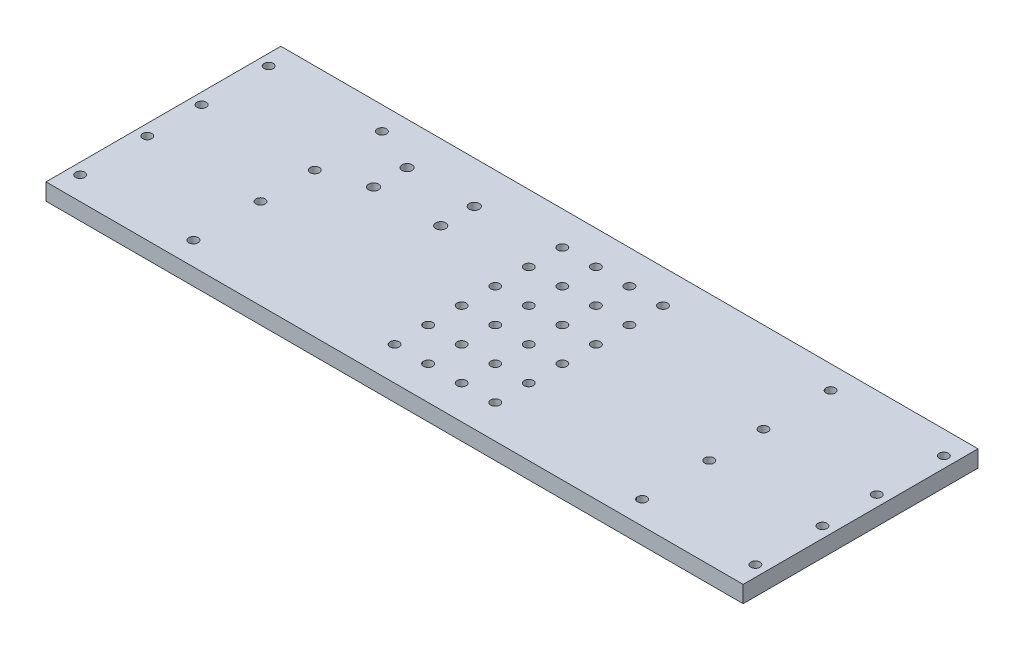
from build123d import *

# Parameters (mm, degrees)
SKETCH1_W              = 263.906
SKETCH1_H              = 88.9
BOSS_EXTRUDE1_DEPTH    = 6.35
F_8_32_TAPPED_HOLE2_D  = 3.4544
F_10_24_TAPPED_HOLE1_D = 3.7973
F_8_32_TAPPED_HOLE3_D  = 3.4544


with BuildPart() as part:
    # Sketch1 → Boss-Extrude1 (new body)
    with BuildSketch(Plane(origin=(0, 0, 0), x_dir=(1, 0, 0), z_dir=(0, 1, 0))):
        with Locations((51.789802803, -18.848747716)):
            Rectangle(SKETCH1_W, SKETCH1_H)
    extrude(amount=BOSS_EXTRUDE1_DEPTH)

    # #8-32 Tapped Hole2 (through all)
    with Locations(Plane(origin=(0, 6.35, 0), x_dir=(1, 0, 0), z_dir=(0, 1, 0))):
        with Locations((-76.003947197, 16.825552284), (-33.141447197, 16.825552284), (-33.141447197, -8.574447716), (-76.003947197, -8.574447716), (-76.003947197, -29.123047716), (-33.141447197, -29.123047716), (-33.141447197, -54.523047716), (-76.003947197, -54.523047716), (179.583552803, 16.825552284), (179.583552803, -8.574447716), (179.583552803, -29.123047716), (179.583552803, -54.523047716), (136.721052803, -54.523047716), (136.721052803, -29.123047716), (136.721052803, -8.574447716), (136.721052803, 16.825552284)):
            Hole(F_8_32_TAPPED_HOLE2_D / 2)

    # #10-24 Tapped Hole1 (through all)
    with Locations(Plane(origin=(0, 6.35, 0), x_dir=(1, 0, 0), z_dir=(0, 1, 0))):
        with Locations((-16.472697197, 9.726252284), (-16.472697197, -2.973747716), (8.927302803, -2.973747716), (8.927302803, 9.726252284)):
            Hole(F_10_24_TAPPED_HOLE1_D / 2)

    # #8-32 Tapped Hole3 (through all)
    with Locations(Plane(origin=(0, 6.35, 0), x_dir=(1, 0, 0), z_dir=(0, 1, 0))):
        with Locations((39.089802803, -50.598747716), (64.489802803, -50.598747716), (51.789802803, -50.598747716), (77.189802803, -50.598747716), (51.789802803, -37.898747716), (77.189802803, -37.898747716), (51.789802803, -25.198747716), (77.189802803, -25.198747716), (51.789802803, -12.498747716), (77.189802803, -12.498747716), (51.789802803, 0.201252284), (77.189802803, 0.201252284), (51.789802803, 12.901252284), (77.189802803, 12.901252284), (39.089802803, -37.898747716), (64.489802803, -37.898747716), (39.089802803, -25.198747716), (64.489802803, -25.198747716), (39.089802803, -12.498747716), (64.489802803, -12.498747716), (39.089802803, 0.201252284), (64.489802803, 0.201252284), (39.089802803, 12.901252284), (64.489802803, 12.901252284)):
            Hole(F_8_32_TAPPED_HOLE3_D / 2)


solid = part.part
